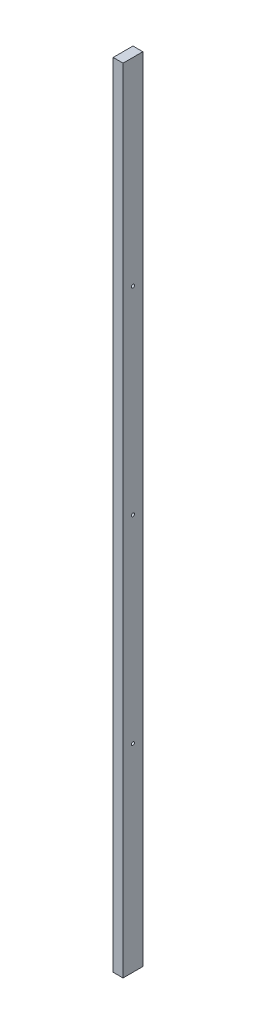
from build123d import *

# Parameters (mm, degrees)
SKETCH_1_W          = 25
SKETCH_1_H          = 50
EXTRUDE_1_DEPTH     = 2000
SKETCH_2_R          = 4
CUT_EXTRUDE_1_DEPTH = 2214.15898255
SKETCH_3_R          = 4
CUT_EXTRUDE_2_DEPTH = 50


with BuildPart() as part:
    # Эскиз1 → Бобышка-Вытянуть1 (new body)
    with BuildSketch(Plane(origin=(0, 0, 0), x_dir=(1, 0, 0), z_dir=(0, 1, 0))):
        Rectangle(SKETCH_1_W, SKETCH_1_H)
    extrude(amount=EXTRUDE_1_DEPTH)

    # Эскиз2 → Вырез-Вытянуть1 (cut)
    with BuildSketch(Plane(origin=(12.5, 0, 0), x_dir=(0, 0, -1), z_dir=(1, 0, 0))):
        with Locations((0, 1500)):
            Circle(SKETCH_2_R)
        with Locations((0, 500)):
            Circle(SKETCH_2_R)
    extrude(amount=-CUT_EXTRUDE_1_DEPTH, mode=Mode.SUBTRACT)

    # Эскиз3 → Вырез-Вытянуть2 (cut)
    with BuildSketch(Plane(origin=(12.5, 0, 0), x_dir=(0, 0, -1), z_dir=(1, 0, 0))):
        with Locations((0, 1000)):
            Circle(SKETCH_3_R)
    extrude(amount=-CUT_EXTRUDE_2_DEPTH, mode=Mode.SUBTRACT)


solid = part.part
